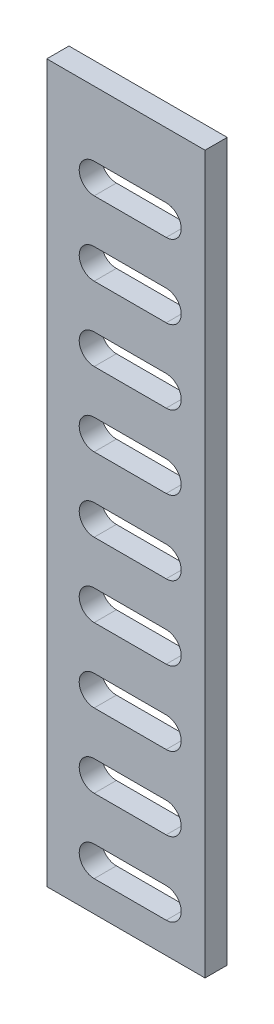
from build123d import *

# Parameters (mm, degrees)
SKETCH1_W           = 21.411233639
SKETCH1_H           = 96.993593864
BOSS_EXTRUDE1_DEPTH = 3


with BuildPart() as part:
    # Sketch1 → Boss-Extrude1 (new body)
    with BuildSketch(Plane.XY):
        with Locations((-91.64577638, 82.405352126)):
            Rectangle(SKETCH1_W, SKETCH1_H)
        with BuildLine():
            Line((-86.19596438, 38.053580074), (-95.937669189, 38.053580074))
            ThreePointArc((-95.937669189, 38.053580074), (-97.965327886, 40.081238771), (-95.937669189, 42.108897468))
            Line((-95.937669189, 42.108897468), (-86.19596438, 42.108897468))
            ThreePointArc((-86.19596438, 42.108897468), (-84.168305683, 40.081238771), (-86.19596438, 38.053580074))
        make_face(mode=Mode.SUBTRACT)
        with BuildLine():
            Line((-86.19596438, 48.053580074), (-95.937669189, 48.053580074))
            ThreePointArc((-95.937669189, 48.053580074), (-97.965327886, 50.081238771), (-95.937669189, 52.108897468))
            Line((-95.937669189, 52.108897468), (-86.19596438, 52.108897468))
            ThreePointArc((-86.19596438, 52.108897468), (-84.168305683, 50.081238771), (-86.19596438, 48.053580074))
        make_face(mode=Mode.SUBTRACT)
        with BuildLine():
            Line((-86.19596438, 58.053580074), (-95.937669189, 58.053580074))
            ThreePointArc((-95.937669189, 58.053580074), (-97.965327886, 60.081238771), (-95.937669189, 62.108897468))
            Line((-95.937669189, 62.108897468), (-86.19596438, 62.108897468))
            ThreePointArc((-86.19596438, 62.108897468), (-84.168305683, 60.081238771), (-86.19596438, 58.053580074))
        make_face(mode=Mode.SUBTRACT)
        with BuildLine():
            Line((-86.19596438, 68.053580074), (-95.937669189, 68.053580074))
            ThreePointArc((-95.937669189, 68.053580074), (-97.965327886, 70.081238771), (-95.937669189, 72.108897468))
            Line((-95.937669189, 72.108897468), (-86.19596438, 72.108897468))
            ThreePointArc((-86.19596438, 72.108897468), (-84.168305683, 70.081238771), (-86.19596438, 68.053580074))
        make_face(mode=Mode.SUBTRACT)
        with BuildLine():
            Line((-86.19596438, 78.053580074), (-95.937669189, 78.053580074))
            ThreePointArc((-95.937669189, 78.053580074), (-97.965327886, 80.081238771), (-95.937669189, 82.108897468))
            Line((-95.937669189, 82.108897468), (-86.19596438, 82.108897468))
            ThreePointArc((-86.19596438, 82.108897468), (-84.168305683, 80.081238771), (-86.19596438, 78.053580074))
        make_face(mode=Mode.SUBTRACT)
        with BuildLine():
            Line((-86.19596438, 88.053580074), (-95.937669189, 88.053580074))
            ThreePointArc((-95.937669189, 88.053580074), (-97.965327886, 90.081238771), (-95.937669189, 92.108897468))
            Line((-95.937669189, 92.108897468), (-86.19596438, 92.108897468))
            ThreePointArc((-86.19596438, 92.108897468), (-84.168305683, 90.081238771), (-86.19596438, 88.053580074))
        make_face(mode=Mode.SUBTRACT)
        with BuildLine():
            Line((-86.19596438, 98.053580074), (-95.937669189, 98.053580074))
            ThreePointArc((-95.937669189, 98.053580074), (-97.965327886, 100.081238771), (-95.937669189, 102.108897468))
            Line((-95.937669189, 102.108897468), (-86.19596438, 102.108897468))
            ThreePointArc((-86.19596438, 102.108897468), (-84.168305683, 100.081238771), (-86.19596438, 98.053580074))
        make_face(mode=Mode.SUBTRACT)
        with BuildLine():
            Line((-86.19596438, 108.053580074), (-95.937669189, 108.053580074))
            ThreePointArc((-95.937669189, 108.053580074), (-97.965327886, 110.081238771), (-95.937669189, 112.108897468))
            Line((-95.937669189, 112.108897468), (-86.19596438, 112.108897468))
            ThreePointArc((-86.19596438, 112.108897468), (-84.168305683, 110.081238771), (-86.19596438, 108.053580074))
        make_face(mode=Mode.SUBTRACT)
        with BuildLine():
            Line((-86.19596438, 118.053580074), (-95.937669189, 118.053580074))
            ThreePointArc((-95.937669189, 118.053580074), (-97.965327886, 120.081238771), (-95.937669189, 122.108897468))
            Line((-95.937669189, 122.108897468), (-86.19596438, 122.108897468))
            ThreePointArc((-86.19596438, 122.108897468), (-84.168305683, 120.081238771), (-86.19596438, 118.053580074))
        make_face(mode=Mode.SUBTRACT)
    extrude(amount=BOSS_EXTRUDE1_DEPTH)


solid = part.part
